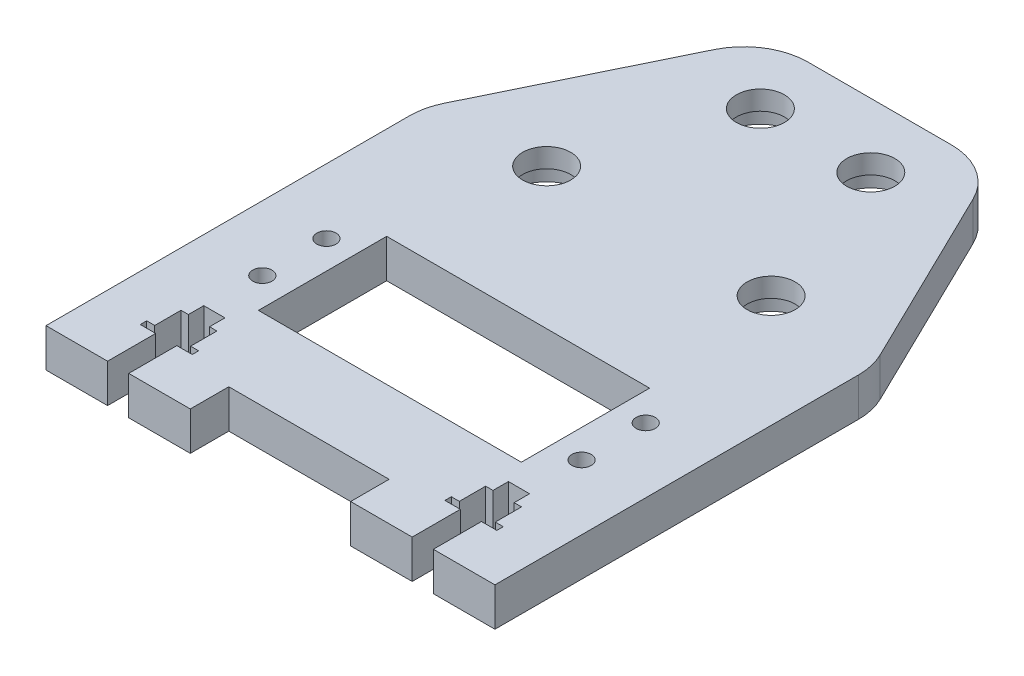
from build123d import *

# Parameters (mm, degrees)
SKETCH1_R           = 1.5
SKETCH1_R_2         = 5.5
SKETCH1_R_3         = 3.75
BOSS_EXTRUDE1_DEPTH = 6
FILLET1_R           = 10
BOSS_EXTRUDE2_START = 3
SKETCH1_3_R         = 5.5
SKETCH1_3_R_2       = 3.75
BOSS_EXTRUDE2_DEPTH = 3
SKETCH1_4_W         = 41
SKETCH1_4_H         = 20
CUT_EXTRUDE2_DEPTH  = 10
SKETCH4_W           = 3.3
SKETCH4_H           = 15
SKETCH4_W_2         = 5.6
SKETCH4_H_2         = 4.1
SKETCH4_W_3         = 8.1
SKETCH4_H_3         = 1
CUT_EXTRUDE3_DEPTH  = 10


with BuildPart() as part:
    # Sketch1 → Boss-Extrude1 (new body)
    with BuildSketch(Plane(origin=(0, 0, 0), x_dir=(1, 0, 0), z_dir=(0, 1, 0))):
        Polygon((17.441626812, 0.78), (-17.441626812, 0.78), (-35, -35.22), (-35, -94.22), (-12.5, -94.22), (-12.5, -88.22), (12.5, -88.22), (12.5, -94.22), (35, -94.22), (35, -35.22), align=None)
        with Locations(Location((-24.889613301, -70.60075616, 0), (0, 0, 270))):
            Circle(SKETCH1_R, mode=Mode.SUBTRACT)
        with Locations(Location((-24.889613301, -60.60075616, 0), (0, 0, 270))):
            Circle(SKETCH1_R, mode=Mode.SUBTRACT)
        with Locations(Location((24.889613301, -70.60075616, 0), (0, 0, 270))):
            Circle(SKETCH1_R, mode=Mode.SUBTRACT)
        with Locations(Location((24.889613301, -60.60075616, 0), (0, 0, 270))):
            Circle(SKETCH1_R, mode=Mode.SUBTRACT)
        with Locations(Location((-17.5, -33.65200814, 0), (0, 0, 270))):
            Circle(SKETCH1_R_2, mode=Mode.SUBTRACT)
        with Locations(Location((-8.607476274, -9.22, 0), (0, 0, 270))):
            Circle(SKETCH1_R_2, mode=Mode.SUBTRACT)
        with Locations(Location((17.5, -33.65200814, 0), (0, 0, 270))):
            Circle(SKETCH1_R_2, mode=Mode.SUBTRACT)
        with Locations(Location((8.607476274, -9.22, 0), (0, 0, 270))):
            Circle(SKETCH1_R_2, mode=Mode.SUBTRACT)
        with Locations(Location((10.3, -65.60075616, 0), (0, 0, 270))):
            Circle(SKETCH1_R_3, mode=Mode.SUBTRACT)
    extrude(amount=BOSS_EXTRUDE1_DEPTH)

    # Fillet1
    fillet1_edges = [part.edges().sort_by_distance(p)[0] for p in [
        (-35, 3, 35.22),
        (-17.441626812, 3, -0.78),
        (17.441626812, 3, -0.78),
        (35, 3, 35.22),
    ]]
    fillet(fillet1_edges, radius=FILLET1_R)

    # Sketch1<3> → Boss-Extrude2 (add)
    # profile 1 of 4: a face of its own
    with BuildSketch(Plane(origin=(0, 0, 0), x_dir=(1, 0, 0), z_dir=(0, 1, 0)).offset(BOSS_EXTRUDE2_START)):
        with Locations(Location((-17.5, -33.65200814, 0), (0, 0, 270))):
            Circle(SKETCH1_3_R)
        with Locations(Location((-17.5, -33.65200814, 0), (0, 0, 270))):
            Circle(SKETCH1_3_R_2, mode=Mode.SUBTRACT)
    # profile 2 of 4: a face of its own
    with BuildSketch(Plane(origin=(0, 0, 0), x_dir=(1, 0, 0), z_dir=(0, 1, 0)).offset(BOSS_EXTRUDE2_START)):
        with Locations(Location((-8.607476274, -9.22, 0), (0, 0, 270))):
            Circle(SKETCH1_3_R)
        with Locations(Location((-8.607476274, -9.22, 0), (0, 0, 270))):
            Circle(SKETCH1_3_R_2, mode=Mode.SUBTRACT)
    # profile 3 of 4: a face of its own
    with BuildSketch(Plane(origin=(0, 0, 0), x_dir=(1, 0, 0), z_dir=(0, 1, 0)).offset(BOSS_EXTRUDE2_START)):
        with Locations(Location((17.5, -33.65200814, 0), (0, 0, 270))):
            Circle(SKETCH1_3_R)
        with Locations(Location((17.5, -33.65200814, 0), (0, 0, 270))):
            Circle(SKETCH1_3_R_2, mode=Mode.SUBTRACT)
    # profile 4 of 4: a face of its own
    with BuildSketch(Plane(origin=(0, 0, 0), x_dir=(1, 0, 0), z_dir=(0, 1, 0)).offset(BOSS_EXTRUDE2_START)):
        with Locations(Location((8.607476274, -9.22, 0), (0, 0, 270))):
            Circle(SKETCH1_3_R)
        with Locations(Location((8.607476274, -9.22, 0), (0, 0, 270))):
            Circle(SKETCH1_3_R_2, mode=Mode.SUBTRACT)
    extrude(amount=BOSS_EXTRUDE2_DEPTH)

    # Sketch1<4> → Cut-Extrude2 (cut)
    with BuildSketch(Plane(origin=(0, 0, 0), x_dir=(1, 0, 0), z_dir=(0, 1, 0))):
        with Locations((0, -65.60075616)):
            Rectangle(SKETCH1_4_W, SKETCH1_4_H)
    extrude(amount=CUT_EXTRUDE2_DEPTH, mode=Mode.SUBTRACT)

    # Sketch4 → Cut-Extrude3 (cut)
    with BuildSketch(Plane.XZ):
        with Locations((-23.75, 86.72)):
            Rectangle(SKETCH4_W, SKETCH4_H)
        with Locations((-23.75, 83.67)):
            Rectangle(SKETCH4_W_2, SKETCH4_H_2)
        with Locations((-23.75, 86.22)):
            Rectangle(SKETCH4_W_3, SKETCH4_H_3)
    cut_extrude3 = extrude(amount=-CUT_EXTRUDE3_DEPTH, mode=Mode.SUBTRACT)

    # Mirror1: Cut-Extrude3 across plane
    add(cut_extrude3.mirror(Plane(origin=(0, 0, 0), x_dir=(0, 0, 1), z_dir=(1, 0, 0))), mode=Mode.SUBTRACT)


solid = part.part
